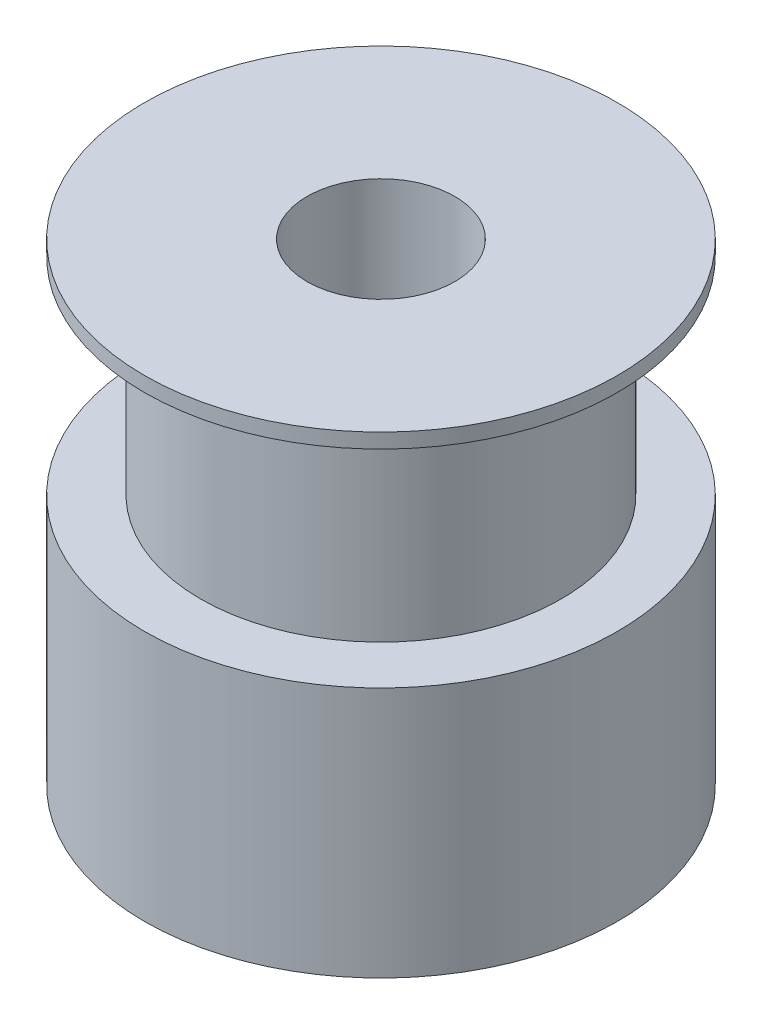
from build123d import *

# Parameters (mm, degrees)
SKETCH1_R           = 8
SKETCH1_R_2         = 2.5
BOSS_EXTRUDE1_DEPTH = 16
SKETCH2_R           = 8.5196911
SKETCH2_R_2         = 6.1
CUT_EXTRUDE1_DEPTH  = 7


with BuildPart() as part:
    # Sketch1 → Boss-Extrude1 (new body)
    with BuildSketch(Plane(origin=(0, 0, 0), x_dir=(1, 0, 0), z_dir=(0, 1, 0))):
        with Locations(Location((0, 0, 0), (0, 0, 270))):
            Circle(SKETCH1_R)
        with Locations(Location((0, 0, 0), (0, 0, 270))):
            Circle(SKETCH1_R_2, mode=Mode.SUBTRACT)
    extrude(amount=BOSS_EXTRUDE1_DEPTH)

    # Sketch2 → Cut-Extrude1 (cut)
    with BuildSketch(Plane(origin=(0, 15.5, 0), x_dir=(1, 0, 0), z_dir=(0, 1, 0))):
        Circle(SKETCH2_R)
        with Locations(Location((0, 0, 0), (0, 0, 270))):
            Circle(SKETCH2_R_2, mode=Mode.SUBTRACT)
    extrude(amount=-CUT_EXTRUDE1_DEPTH, mode=Mode.SUBTRACT)


solid = part.part
